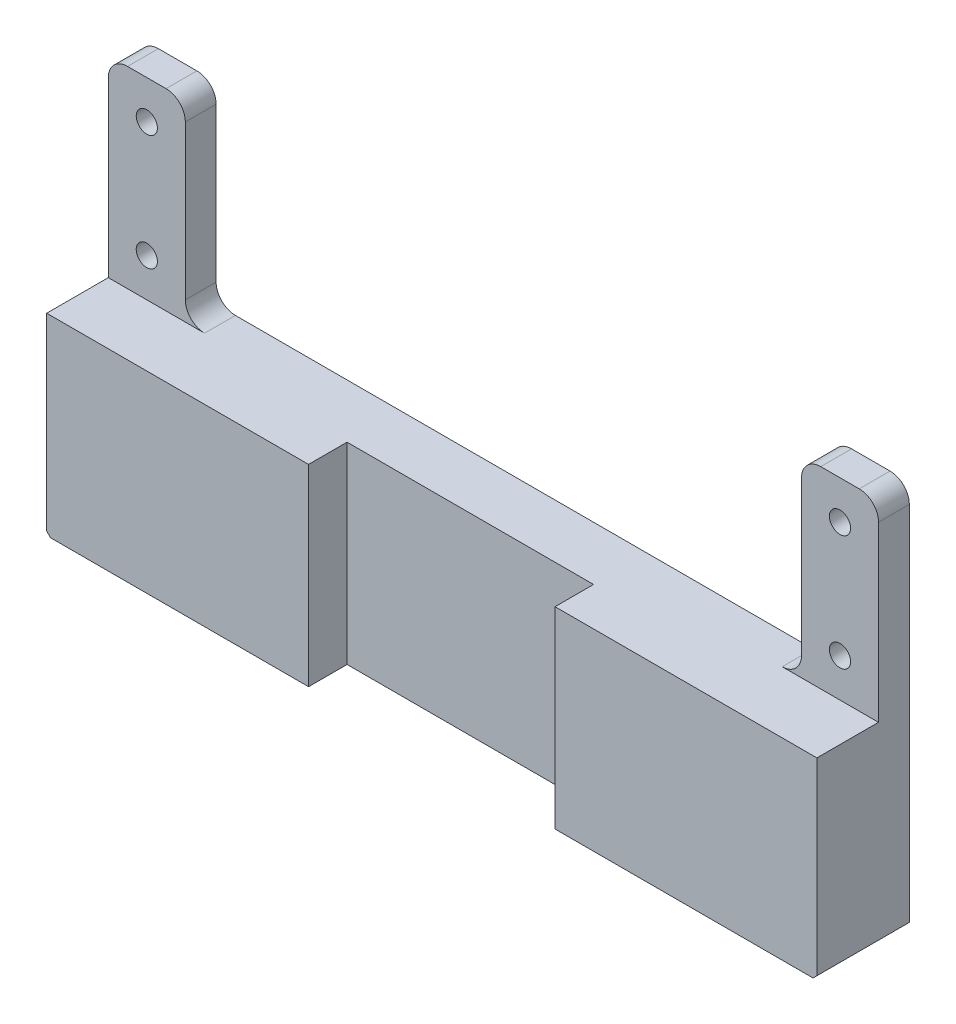
from build123d import *

# Parameters (mm, degrees)
BOSS_EXTRUDE1_DEPTH  = 50
SKETCH2_W            = 20
SKETCH2_H            = 8
BOSS_EXTRUDE2_DEPTH  = 50
M5_CLEARANCE_HOLE1_D = 5.5
FILLET1_R            = 5
CHAMFER1_SIZE        = 1


with BuildPart() as part:
    # Sketch1 → Boss-Extrude1 (new body)
    with BuildSketch(Plane(origin=(0, 0, 0), x_dir=(1, 0, 0), z_dir=(0, 1, 0))):
        Polygon((-100, 8), (100, 8), (100, -16), (32, -16), (32, -6), (-32, -6), (-32, -16), (-100, -16), align=None)
    extrude(amount=-BOSS_EXTRUDE1_DEPTH)

    # Sketch2 → Boss-Extrude2 (add)
    with BuildSketch(Plane(origin=(0, 0, 0), x_dir=(1, 0, 0), z_dir=(0, 1, 0))):
        with Locations((-90, 4)):
            Rectangle(SKETCH2_W, SKETCH2_H)
        with Locations((90, 4)):
            Rectangle(SKETCH2_W, SKETCH2_H)
    extrude(amount=BOSS_EXTRUDE2_DEPTH)

    # M5 Clearance Hole1 (through all)
    with Locations(Plane(origin=(0, 0, -8), x_dir=(-1, 0, 0), z_dir=(0, 0, -1))):
        with Locations((-90, 40), (90, 10), (-90, 10), (90, 40)):
            Hole(M5_CLEARANCE_HOLE1_D / 2)

    # Fillet1
    fillet1_edges = [part.edges().sort_by_distance(p)[0] for p in [
        (-80, 0, -4),
        (-100, 50, -4),
        (-80, 50, -4),
        (80, 0, -4),
        (100, 50, -4),
        (80, 50, -4),
    ]]
    fillet(fillet1_edges, radius=FILLET1_R)

    # Chamfer1
    chamfer1_edges = [part.edges().sort_by_distance(p)[0] for p in [
        (100, -50, 4),
        (-100, -50, 4),
    ]]
    chamfer(chamfer1_edges, length=CHAMFER1_SIZE)


solid = part.part
